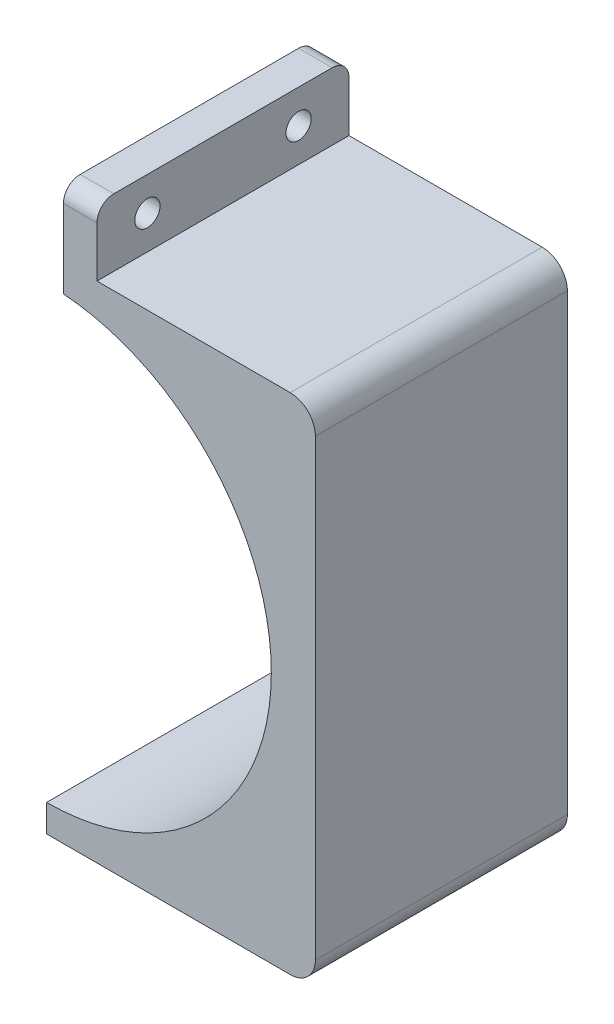
from build123d import *

# Parameters (mm, degrees)
EXTRUDE_1_DEPTH     = 30
FILLET_1_R          = 3
SKETCH_3_R          = 2
CUT_EXTRUDE_1_DEPTH = 7
SKETCH_4_R          = 1.5
CUT_EXTRUDE_2_DEPTH = 62.546730214
SKETCH_5_W          = 141.789042775
SKETCH_5_H          = 177.448562515
CUT_EXTRUDE_3_DEPTH = 59.034472514
FILLET_2_R          = 2


with BuildPart() as part:
    # 草图1 → 凸台-拉伸1 (new body)
    with BuildSketch(Plane.XY):
        with BuildLine():
            Line((-32, 30), (-6, 30))
            Line((-6, 30), (-6, 38))
            Line((-6, 38), (-2, 38))
            Line((-2, 38), (-2, 28.659348025))
            Line((-2, 28.659348025), (-2, 26.675128866))
            ThreePointArc((-2, 26.675128866), (0, -26.75), (2, 26.675128866))
            Line((2, 26.675128866), (2, 28.659348025))
            Line((2, 28.659348025), (2, 38))
            Line((2, 38), (6, 38))
            Line((6, 38), (6, 30))
            Line((6, 30), (32, 30))
            Line((32, 30), (32, -30))
            Line((32, -30), (-32, -30))
            Line((-32, -30), (-32, 30))
        make_face()
    extrude(amount=EXTRUDE_1_DEPTH)

    # 圆角1
    fillet_1_edges = [part.edges().sort_by_distance(p)[0] for p in [
        (32, -30, 15),
        (-32, -30, 15),
        (-32, 30, 15),
        (32, 30, 15),
    ]]
    fillet(fillet_1_edges, radius=FILLET_1_R)

    # 草图3 → 切除-拉伸1 (cut)
    with BuildSketch(Plane.XZ.offset(30)):
        with Locations(Location((19, 24, 0), (0, 0, 270))):
            Circle(SKETCH_3_R)
        with Locations(Location((19, 6, 0), (0, 0, 270))):
            Circle(SKETCH_3_R)
    extrude(amount=-CUT_EXTRUDE_1_DEPTH, mode=Mode.SUBTRACT)

    # 草图4 → 切除-拉伸2 (cut, through all)
    with BuildSketch(Plane(origin=(6, 0, 0), x_dir=(0, 0, -1), z_dir=(1, 0, 0))):
        with Locations((-24, 34)):
            Circle(SKETCH_4_R)
        with Locations((-6, 34)):
            Circle(SKETCH_4_R)
    extrude(amount=-CUT_EXTRUDE_2_DEPTH, mode=Mode.SUBTRACT)

    # 草图5 → 切除-拉伸3 (cut, through all)
    with BuildSketch(Plane(origin=(0, 0, 0), x_dir=(0, 0, -1), z_dir=(1, 0, 0))):
        with Locations((-47.884475127, 49.870130309)):
            Rectangle(SKETCH_5_W, SKETCH_5_H)
    extrude(amount=-CUT_EXTRUDE_3_DEPTH, mode=Mode.SUBTRACT)

    # 圆角2
    fillet_2_edges = [part.edges().sort_by_distance(p)[0] for p in [
        (4, 38, 30),
        (4, 38, 0),
    ]]
    fillet(fillet_2_edges, radius=FILLET_2_R)


solid = part.part
